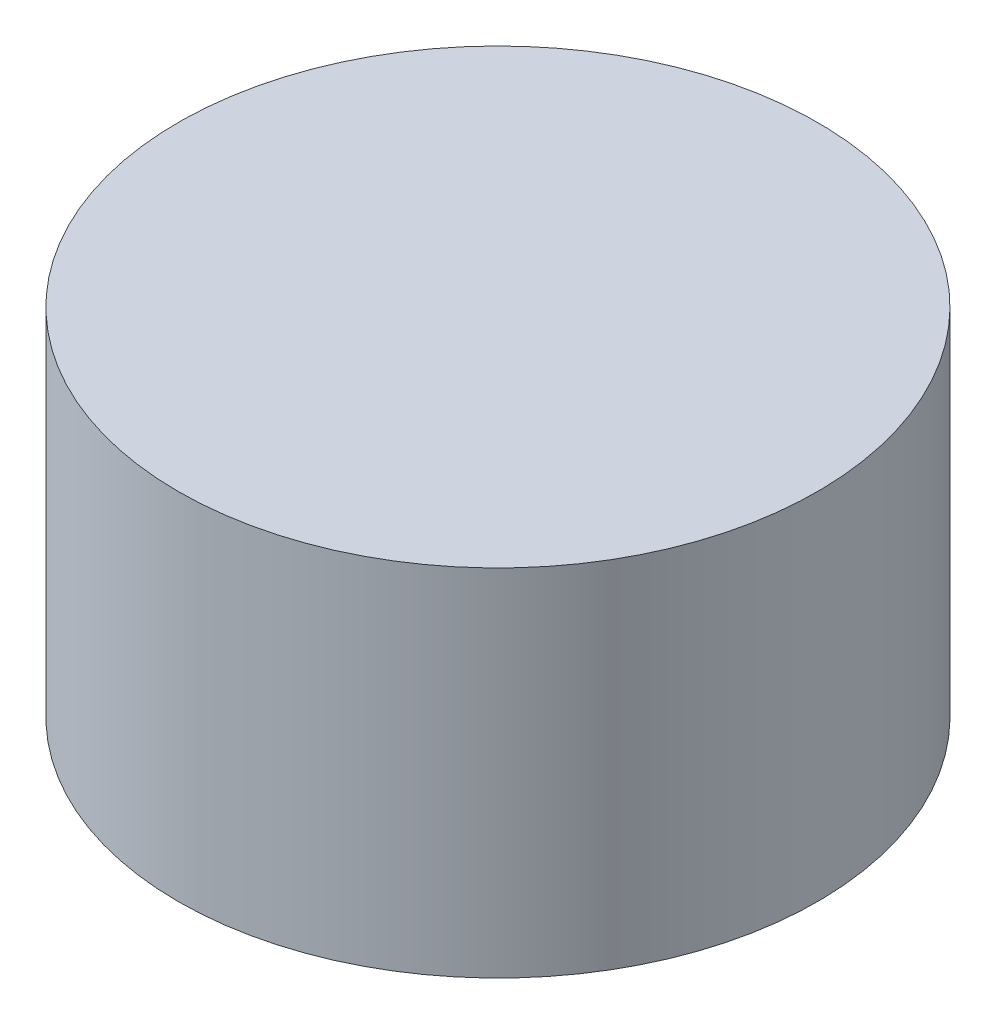
from build123d import *

# Parameters (mm, degrees)
SKETCH1_R           = 45
BOSS_EXTRUDE1_DEPTH = 50


with BuildPart() as part:
    # Sketch1 → Boss-Extrude1 (new body)
    with BuildSketch(Plane(origin=(0, 0, 0), x_dir=(1, 0, 0), z_dir=(0, 1, 0))):
        with Locations(Location((0, 0, 0), (0, 0, 270))):
            Circle(SKETCH1_R)
    extrude(amount=BOSS_EXTRUDE1_DEPTH)


solid = part.part
